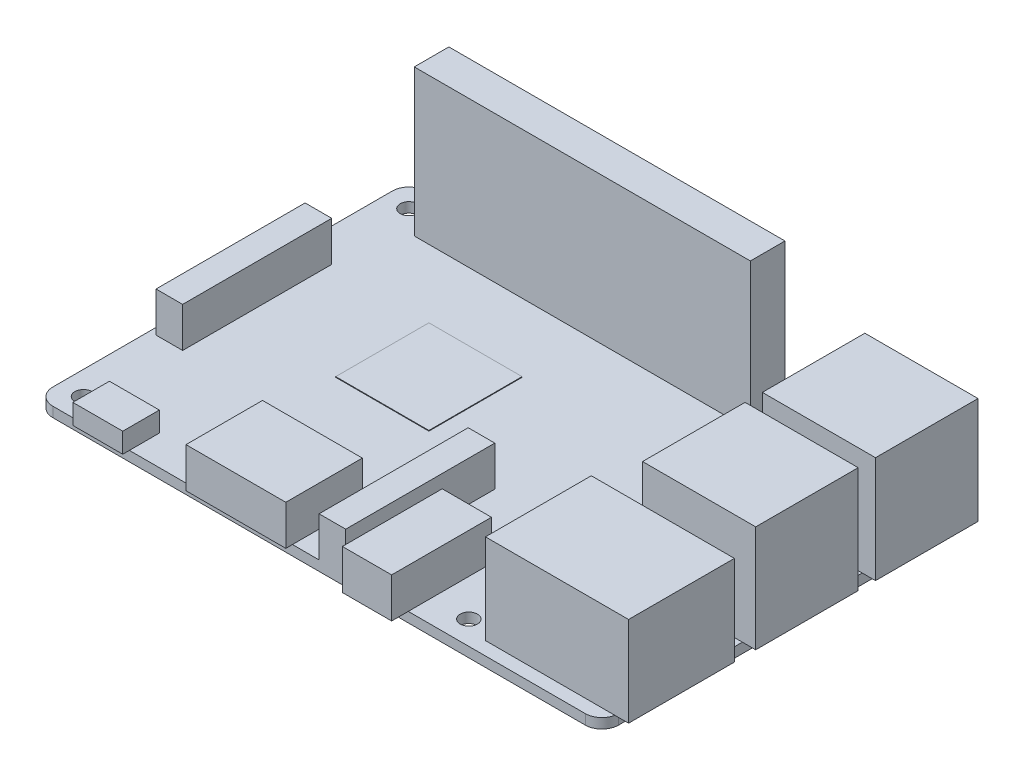
from build123d import *

# Parameters (mm, degrees)
SKETCH1_W           = 85
SKETCH1_H           = 56
BOSS_EXTRUDE1_DEPTH = 1.5
FILLET1_R           = 2.5
SKETCH2_R           = 1.3
CUT_EXTRUDE1_DEPTH  = 51.916598472
SKETCH3_W           = 14
SKETCH3_H           = 14
BOSS_EXTRUDE2_DEPTH = 0.1
SKETCH4_W           = 50.5
SKETCH4_H           = 5.2
BOSS_EXTRUDE3_DEPTH = 22
SKETCH5_W           = 7.5
SKETCH5_H           = 5.5
BOSS_EXTRUDE4_DEPTH = 3
SKETCH6_W           = 4
SKETCH6_H           = 22.4
SKETCH6_W_2         = 15
SKETCH6_H_2         = 11.5
SKETCH6_W_3         = 7.4
SKETCH6_H_3         = 15
BOSS_EXTRUDE5_DEPTH = 6
SKETCH7_W           = 21.5
SKETCH7_H           = 15.9
BOSS_EXTRUDE6_DEPTH = 13.5
SKETCH7_3_W         = 17
SKETCH7_3_H         = 15.4
BOSS_EXTRUDE7_DEPTH = 16


with BuildPart() as part:
    # Sketch1 → Boss-Extrude1 (new body)
    with BuildSketch(Plane(origin=(0, 0, 0), x_dir=(1, 0, 0), z_dir=(0, 1, 0))):
        Rectangle(SKETCH1_W, SKETCH1_H)
    extrude(amount=BOSS_EXTRUDE1_DEPTH)

    # Fillet1
    fillet1_edges = [part.edges().sort_by_distance(p)[0] for p in [
        (-42.5, 0.75, 28),
        (-42.5, 0.75, -28),
        (42.5, 0.75, -28),
        (42.5, 0.75, 28),
    ]]
    fillet(fillet1_edges, radius=FILLET1_R)

    # Sketch2 → Cut-Extrude1 (cut, through all)
    with BuildSketch(Plane(origin=(0, 1.5, 0), x_dir=(1, 0, 0), z_dir=(0, 1, 0))):
        with Locations((-38.95, -24.45)):
            Circle(SKETCH2_R)
        with Locations((-38.95, 24.45)):
            Circle(SKETCH2_R)
        with Locations((18.95, 24.45)):
            Circle(SKETCH2_R)
        with Locations((18.95, -24.45)):
            Circle(SKETCH2_R)
    extrude(amount=-CUT_EXTRUDE1_DEPTH, mode=Mode.SUBTRACT)

    # Sketch3 → Boss-Extrude2 (add)
    with BuildSketch(Plane(origin=(0, 1.5, 0), x_dir=(1, 0, 0), z_dir=(0, 1, 0))):
        with Locations((-15.5, 4)):
            Rectangle(SKETCH3_W, SKETCH3_H)
    extrude(amount=BOSS_EXTRUDE2_DEPTH)

    # Sketch4 → Boss-Extrude3 (add)
    with BuildSketch(Plane(origin=(0, 1.5, 0), x_dir=(1, 0, 0), z_dir=(0, 1, 0))):
        with Locations((-9.75, 23.9)):
            Rectangle(SKETCH4_W, SKETCH4_H)
    extrude(amount=BOSS_EXTRUDE3_DEPTH)

    # Sketch5 → Boss-Extrude4 (add)
    with BuildSketch(Plane(origin=(0, 1.5, 0), x_dir=(1, 0, 0), z_dir=(0, 1, 0))):
        with Locations((-32.25, -26.25)):
            Rectangle(SKETCH5_W, SKETCH5_H)
    extrude(amount=BOSS_EXTRUDE4_DEPTH)

    # Sketch6 → Boss-Extrude5 (add)
    with BuildSketch(Plane(origin=(0, 1.5, 0), x_dir=(1, 0, 0), z_dir=(0, 1, 0))):
        with Locations((2, -16.8)):
            Rectangle(SKETCH6_W, SKETCH6_H)
        with Locations((-39.5, 0.2)):
            Rectangle(SKETCH6_W, SKETCH6_H)
        with Locations((-11.5, -23.25)):
            Rectangle(SKETCH6_W_2, SKETCH6_H_2)
        with Locations((9.7, -23)):
            Rectangle(SKETCH6_W_3, SKETCH6_H_3)
    extrude(amount=BOSS_EXTRUDE5_DEPTH)

    # Sketch7 → Boss-Extrude6 (add)
    with BuildSketch(Plane(origin=(0, 1.5, 0), x_dir=(1, 0, 0), z_dir=(0, 1, 0))):
        with Locations((33.75, -18.05)):
            Rectangle(SKETCH7_W, SKETCH7_H)
    extrude(amount=BOSS_EXTRUDE6_DEPTH)

    # Sketch7<3> → Boss-Extrude7 (add)
    with BuildSketch(Plane(origin=(0, 1.5, 0), x_dir=(1, 0, 0), z_dir=(0, 1, 0))):
        with Locations((36, 18.8)):
            Rectangle(SKETCH7_3_W, SKETCH7_3_H)
        with Locations((36, 0.8)):
            Rectangle(SKETCH7_3_W, SKETCH7_3_H)
    extrude(amount=BOSS_EXTRUDE7_DEPTH)


solid = part.part
